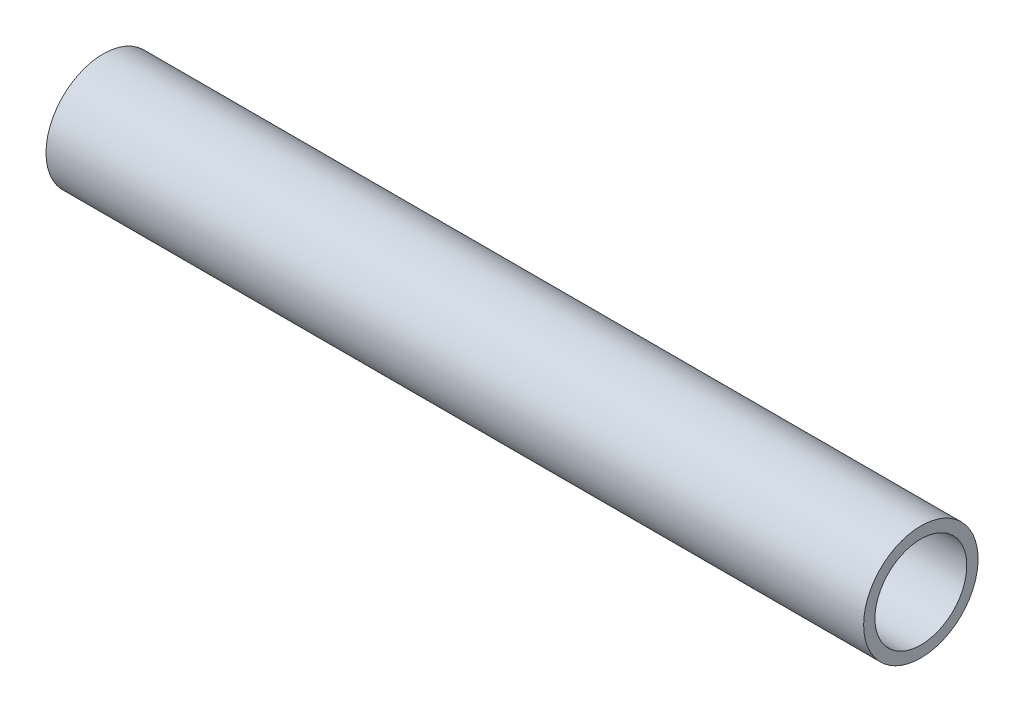
from build123d import *

# Parameters (mm, degrees)
SKETCH1_R      = 10.668
SKETCH1_R_2    = 8.5598
EXTRUDE1_DEPTH = 76.2


with BuildPart() as part:
    # Sketch1 → Extrude1 (new, symmetric)
    with BuildSketch(Plane(origin=(0, 0, 0), x_dir=(0, 0, -1), z_dir=(1, 0, 0))):
        with Locations(Location((0, 0, 0), (0, 0, 180))):
            Circle(SKETCH1_R)
        with Locations(Location((0, 0, 0), (0, 0, 180))):
            Circle(SKETCH1_R_2, mode=Mode.SUBTRACT)
    extrude(amount=EXTRUDE1_DEPTH, both=True)


solid = part.part
